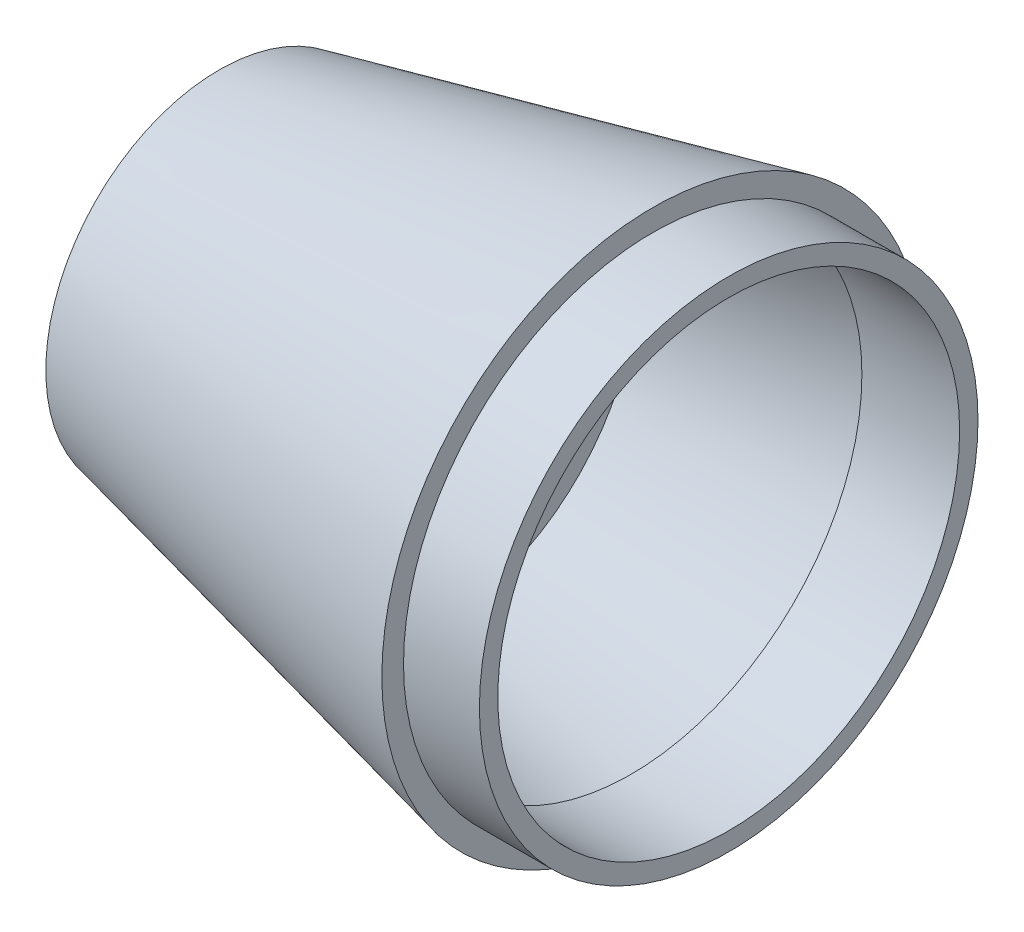
from build123d import *


with BuildPart() as part:
    # Sketch1 → Revolve4 (revolve)
    with BuildSketch(Plane.XY, mode=Mode.PRIVATE) as revolve4_sk:
        Polygon((-12.065, 10.16), (-12.065, 8.89), (-0.848332369, 11.413750217), (-0.848332369, 0), (0.635, 0), (0.635, 11.7475), (12.056573738, 14.317354091), (12.056573738, 13.528602452), (17.781150083, 13.528602452), (17.781150083, 14.605), (13.335, 14.605), (13.335, 15.875), align=None)
    revolve(revolve4_sk.sketch.rotate(Axis((44.726440805, 0, 0), (-1, 0, 0)), 90), axis=Axis((44.726440805, 0, 0), (-1, 0, 0)))


solid = part.part
